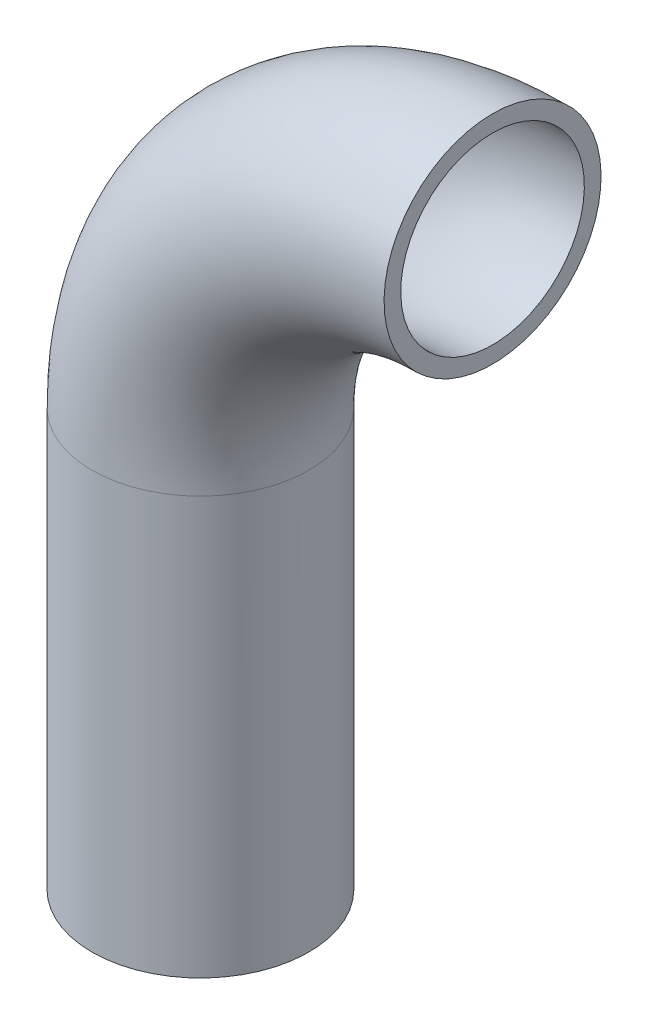
from build123d import *

# Parameters (mm, degrees)
SKETCH1_R = 13
SKETCH3_R = 11


with BuildPart() as part:
    # Sweep1: sweep along a path in Sketch2
    with BuildLine(Plane.XY) as sweep1_path:
        Line((0, 0), (0, 50))
        ThreePointArc((0, 50), (10.251262658, 74.748737342), (35, 85))
    # Sketch1 → Sweep1 (sweep)
    with BuildSketch(Plane(origin=(0, 0, 0), x_dir=(1, 0, 0), z_dir=(0, 1, 0))):
        Circle(SKETCH1_R)
    sweep(path=sweep1_path.line)

    # Cut-Sweep1: sweep along a path in Sketch2<2>
    with BuildLine(Plane.XY) as cut_sweep1_path:
        Line((0, 0), (0, 50))
        ThreePointArc((0, 50), (10.251262658, 74.748737342), (35, 85))
    # Sketch3 → Cut-Sweep1 (sweep, cut)
    with BuildSketch(Plane(origin=(0, 0, 0), x_dir=(1, 0, 0), z_dir=(0, 1, 0))):
        Circle(SKETCH3_R)
    sweep(path=cut_sweep1_path.line, mode=Mode.SUBTRACT)


solid = part.part
